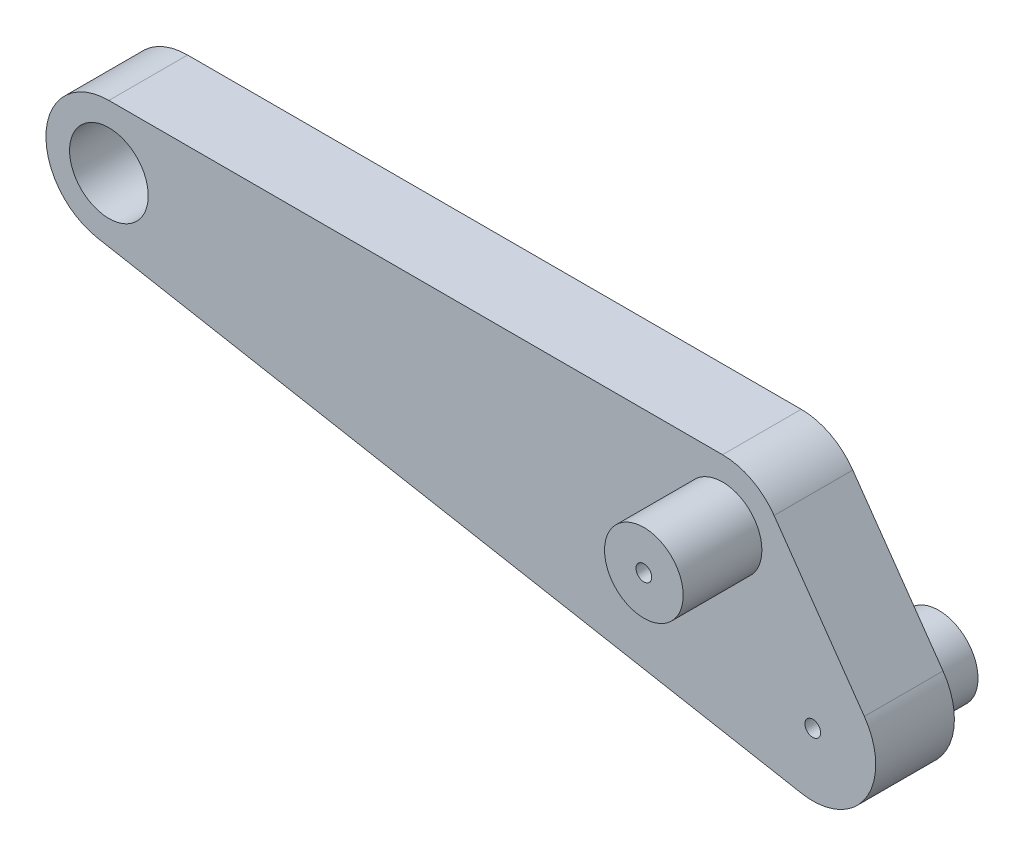
from build123d import *

# Parameters (mm, degrees)
SKETCH2_R           = 2.5
BOSS_EXTRUDE1_DEPTH = 5
BOSS_EXTRUDE2_START = -8
SKETCH3_R           = 2.5
SKETCH3_R_2         = 0.5
BOSS_EXTRUDE2_DEPTH = 8
SKETCH4_R           = 2.5
SKETCH4_R_2         = 0.5
BOSS_EXTRUDE3_DEPTH = 10


with BuildPart() as part:
    # Sketch2 → Boss-Extrude1 (new body)
    with BuildSketch(Plane.XY):
        with BuildLine():
            Line((-39, 4), (0, 4))
            ThreePointArc((0, 4), (1.846994453, 3.548043333), (3.276608177, 2.294305745))
            Line((3.276608177, 2.294305745), (9.012372541, -5.897214697))
            ThreePointArc((9.012372541, -5.897214697), (9.102252069, -10.351789068), (5.015306915, -12.126103148))
            Line((5.015306915, -12.126103148), (-39.720457449, -3.934582705))
            ThreePointArc((-39.720457449, -3.934582705), (-42.983612106, 0.361710643), (-39, 4))
        make_face()
        with Locations((-39, 0)):
            Circle(SKETCH2_R, mode=Mode.SUBTRACT)
        Circle(SKETCH2_R, mode=Mode.SUBTRACT)
        with Locations((5.735764364, -8.191520443)):
            Circle(SKETCH2_R, mode=Mode.SUBTRACT)
    extrude(amount=BOSS_EXTRUDE1_DEPTH)

    # Sketch3 → Boss-Extrude2 (add)
    with BuildSketch(Plane.XY.offset(5).offset(BOSS_EXTRUDE2_START)):
        with Locations((5.735764364, -8.191520443)):
            Circle(SKETCH3_R)
        with Locations((5.735764364, -8.191520443)):
            Circle(SKETCH3_R_2, mode=Mode.SUBTRACT)
    extrude(amount=BOSS_EXTRUDE2_DEPTH)

    # Sketch4 → Boss-Extrude3 (add)
    with BuildSketch(Plane(origin=(0, 0, 0), x_dir=(-1, 0, 0), z_dir=(0, 0, -1))):
        Circle(SKETCH4_R)
        Circle(SKETCH4_R_2, mode=Mode.SUBTRACT)
    extrude(amount=-BOSS_EXTRUDE3_DEPTH)


solid = part.part
